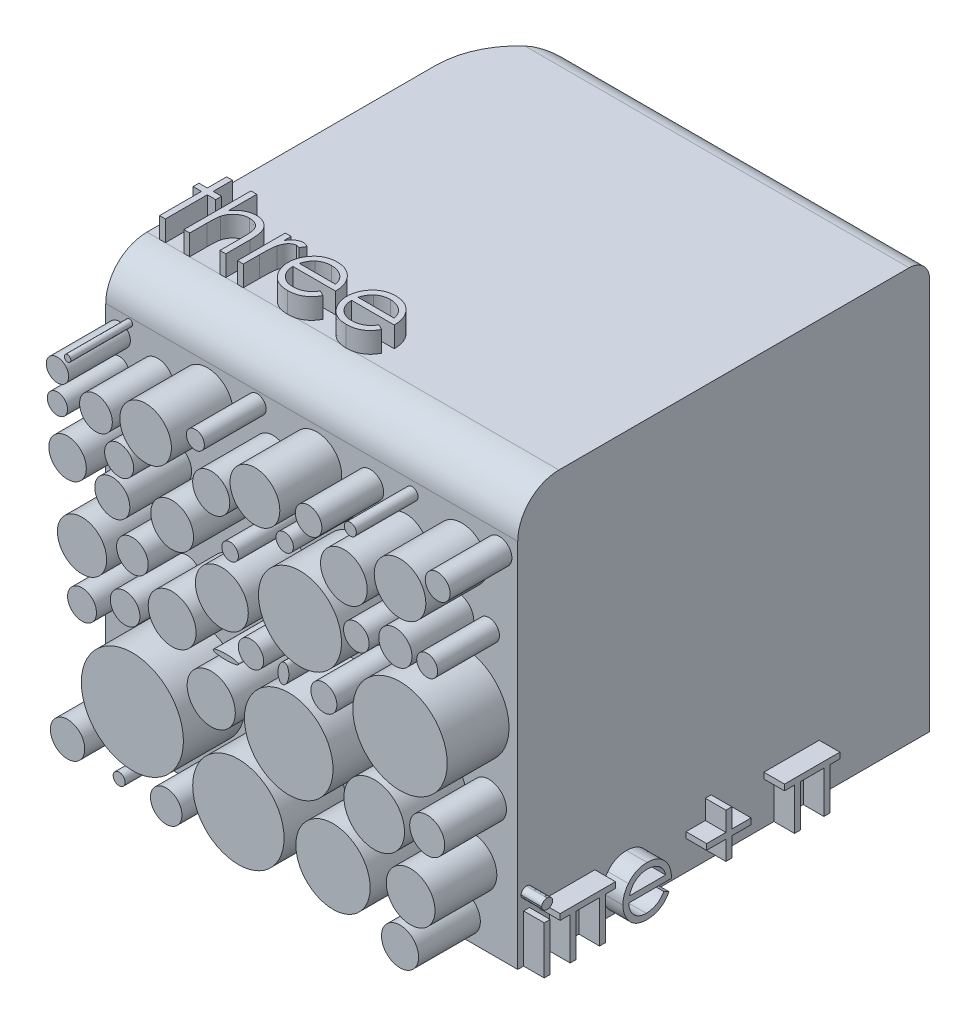
from build123d import *
from OCP.BRepFilletAPI import BRepFilletAPI_MakeFillet

# Parameters (mm, degrees)
SKETCH2_W           = 20
SKETCH2_H           = 20
BOSS_EXTRUDE1_DEPTH = 20
SKETCH3_W           = 0.284935898
SKETCH3_H           = 2.320192308
BOSS_EXTRUDE2_DEPTH = 1
FILLET1_R1          = 2
FILLET1_R2          = 1
FILLET1_R3          = 4
BOSS_EXTRUDE3_DEPTH = 1
SKETCH5_R           = 0.869274054
SKETCH5_R_2         = 1.87334708
SKETCH5_R_3         = 1.224259222
SKETCH5_R_4         = 0.854359486
SKETCH5_R_5         = 0.723058737
SKETCH5_R_6         = 0.828150602
SKETCH5_R_7         = 1.20534194
SKETCH5_R_8         = 2.196982283
SKETCH5_R_9         = 1.648859169
SKETCH5_R_10        = 0.887298728
SKETCH5_R_11        = 1.198491665
SKETCH5_R_12        = 1.240938395
SKETCH5_R_13        = 1.52286101
SKETCH5_R_14        = 2.08407997
SKETCH5_R_15        = 1.116428312
SKETCH5_R_16        = 0.510356374
SKETCH5_R_17        = 0.928303522
SKETCH5_R_18        = 1.048285303
SKETCH5_R_19        = 1.120954627
SKETCH5_R_20        = 1.035138007
SKETCH5_R_21        = 1.063032749
SKETCH5_R_22        = 0.901829478
SKETCH5_R_23        = 0.83084329
SKETCH5_R_24        = 0.806786337
SKETCH5_R_25        = 0.775997991
SKETCH5_R_26        = 0.848871038
SKETCH5_R_27        = 0.739481873
SKETCH5_R_28        = 1.066466648
SKETCH5_R_29        = 0.843889534
SKETCH5_R_30        = 0.704115082
SKETCH5_R_31        = 0.319725843
SKETCH5_R_32        = 0.681387214
SKETCH5_R_33        = 0.790534868
SKETCH5_R_34        = 0.573713006
SKETCH5_R_35        = 0.533233324
SKETCH5_R_36        = 0.625054899
SKETCH5_R_37        = 0.340042365
SKETCH5_R_38        = 0.519725647
SKETCH5_R_39        = 0.813729973
SKETCH5_R_40        = 0.720290961
SKETCH5_R_41        = 0.811333119
SKETCH5_R_42        = 0.907849135
SKETCH5_R_43        = 0.760866236
SKETCH5_R_44        = 0.443440105
SKETCH5_R_45        = 0.505502597
SKETCH5_R_46        = 0.653372918
SKETCH5_R_47        = 0.821463246
SKETCH5_R_48        = 0.243410693
SKETCH5_R_49        = 0.331818637
SKETCH5_R_50        = 0.58557289
SKETCH5_R_51        = 0.913548579
SKETCH5_R_52        = 0.618089992
SKETCH5_R_53        = 0.33645039
SKETCH5_R_54        = 0.353045631
SKETCH5_R_55        = 0.558214156
SKETCH5_R_56        = 0.708578995
SKETCH5_R_57        = 0.386937988
SKETCH5_R_58        = 0.620695254
SKETCH5_R_59        = 0.450911284
SKETCH5_R_60        = 0.446571325
SKETCH5_R_61        = 0.637073751
SKETCH5_R_62        = 0.354108624
SKETCH5_R_63        = 0.719749999
SKETCH5_RX          = 0.571418379
SKETCH5_RY          = 0.334928494
BOSS_EXTRUDE4_DEPTH = 4
SKETCH6_R           = 0.794272448
SKETCH6_R_2         = 0.85045789
SKETCH6_R_3         = 0.901030327
SKETCH6_R_4         = 1.16174239
SKETCH6_R_5         = 1.038098205
SKETCH6_R_6         = 2.014765062
SKETCH6_R_7         = 2.14961737
SKETCH6_R_8         = 2.477089822
SKETCH6_R_9         = 1.183351901
SKETCH6_R_10        = 2.217815956
SKETCH6_R_11        = 1.803840094
SKETCH6_R_12        = 1.195092222
SKETCH6_R_13        = 0.702366469
SKETCH6_R_14        = 1.252556633
SKETCH6_R_15        = 2.290309651
SKETCH6_R_16        = 1.471259211
SKETCH6_R_17        = 1.284780558
SKETCH6_R_18        = 1.169284811
SKETCH6_R_19        = 0.719100487
SKETCH6_R_20        = 0.910166483
SKETCH6_R_21        = 1.250904183
SKETCH6_R_22        = 0.643183028
SKETCH6_R_23        = 1.207146771
SKETCH6_R_24        = 1.133501294
SKETCH6_R_25        = 0.806547414
SKETCH6_R_26        = 0.403167986
SKETCH6_R_27        = 0.767115422
SKETCH6_R_28        = 0.492725753
SKETCH6_R_29        = 0.157493034
SKETCH6_R_30        = 0.541714877
SKETCH6_R_31        = 0.436948105
SKETCH6_R_32        = 0.614399725
SKETCH6_R_33        = 0.834280538
SKETCH6_R_34        = 0.764414303
SKETCH6_R_35        = 0.289432363
SKETCH6_R_36        = 0.90045624
SKETCH6_R_37        = 0.84902596
SKETCH6_R_38        = 0.633160864
SKETCH6_R_39        = 0.705305254
SKETCH6_R_40        = 0.508480831
SKETCH6_R_41        = 0.621454766
SKETCH6_R_42        = 0.603096786
SKETCH6_R_43        = 0.422088862
SKETCH6_RX          = 0.486141315
SKETCH6_RY          = 0.259275368
SKETCH6_RX_2        = 0.611023877
SKETCH6_RY_2        = 0.128636606
BOSS_EXTRUDE5_DEPTH = 3
SKETCH8_W           = 0.284935897
SKETCH8_H           = 3.256410256
BOSS_EXTRUDE6_DEPTH = 1


with BuildPart() as part:
    # Sketch2 → Boss-Extrude1 (new body)
    with BuildSketch(Plane(origin=(0, 0, 0), x_dir=(1, 0, 0), z_dir=(0, 1, 0))):
        with Locations((10, -10)):
            Rectangle(SKETCH2_W, SKETCH2_H)
    extrude(amount=BOSS_EXTRUDE1_DEPTH)

    # Sketch3 → Boss-Extrude2 (add)
    # profile 1 of 6: a face of its own
    with BuildSketch(Plane(origin=(20, 0, 0), x_dir=(0, 0, -1), z_dir=(1, 0, 0))):
        with BuildLine():
            add(Edge.make_bspline(
                [(-19.573868189, 3.297115385), (-19.556186781, 3.296295189), (-19.521563189, 3.294689089), (-19.47149501, 3.280935463), (-19.425904721, 3.257622177), (-19.385466349, 3.226344181), (-19.350766423, 3.189560043), (-19.326472493, 3.146687593), (-19.310858391, 3.100370114), (-19.308972844, 3.06806214), (-19.308012821, 3.05161258)],
                knots=[0, 0, 0, 0, 1.055194115, 2.066272739, 3.074728998, 4.095836921, 5.109056067, 6.073838105, 7.019297344, 8, 8, 8, 8], degree=3))
            add(Edge.make_bspline(
                [(-19.308012821, 3.05161258), (-19.308994494, 3.03559003), (-19.310935147, 3.003915346), (-19.326460432, 2.958400839), (-19.350973462, 2.916124096), (-19.385444098, 2.879411381), (-19.425910617, 2.848150675), (-19.471493444, 2.824832805), (-19.521563601, 2.811080395), (-19.55618692, 2.809474127), (-19.573868189, 2.808653846)],
                knots=[0, 0, 0, 0, 0.96129708, 1.900370562, 2.859976407, 3.87933698, 4.906634145, 5.921202961, 6.938410037, 8, 8, 8, 8], degree=3))
            add(Edge.make_bspline(
                [(-19.573868189, 2.808653846), (-19.591347267, 2.809442807), (-19.625368009, 2.810978415), (-19.674686502, 2.825102646), (-19.71988806, 2.848158655), (-19.760405299, 2.879206694), (-19.794178403, 2.916349565), (-19.818760455, 2.958375039), (-19.834249885, 3.003921915), (-19.836195369, 3.035592237), (-19.837179487, 3.05161258)],
                knots=[0, 0, 0, 0, 1.054934014, 2.053291228, 3.073705704, 4.106921865, 5.123545215, 6.088680038, 7.033164197, 8, 8, 8, 8], degree=3))
            add(Edge.make_bspline(
                [(-19.837179487, 3.05161258), (-19.83621693, 3.068059851), (-19.834326407, 3.100363328), (-19.818748845, 3.146713822), (-19.794383162, 3.189332756), (-19.760382936, 3.226548745), (-19.719894012, 3.257614247), (-19.674684964, 3.280665637), (-19.625368416, 3.294791066), (-19.591347405, 3.296326509), (-19.573868189, 3.297115385)],
                knots=[0, 0, 0, 0, 0.98631895, 1.937192651, 2.907499808, 3.917963147, 4.944918757, 5.95915025, 6.951458133, 8, 8, 8, 8], degree=3))
        make_face()
    # profile 2 of 6: a face of its own
    with BuildSketch(Plane(origin=(20, 0, 0), x_dir=(0, 0, -1), z_dir=(1, 0, 0))):
        with Locations((-19.572596154, 1.160096154)):
            Rectangle(SKETCH3_W, SKETCH3_H)
    # profile 3 of 6: a face of its own
    with BuildSketch(Plane(origin=(20, 0, 0), x_dir=(0, 0, -1), z_dir=(1, 0, 0))):
        Polygon((-16.256585145, 2.03525641), (-16.745046683, 2.03525641), (-16.745046683, 0), (-17.029982581, 0), (-17.029982581, 2.03525641), (-18.169726171, 2.03525641), (-18.169726171, 0), (-18.454662068, 0), (-18.454662068, 2.03525641), (-18.943123606, 2.03525641), (-18.943123606, 2.320192308), (-16.256585145, 2.320192308), align=None)
    # profile 4 of 6: a face of its own
    with BuildSketch(Plane(origin=(20, 0, 0), x_dir=(0, 0, -1), z_dir=(1, 0, 0))):
        with BuildLine():
            Line((-13.909152811, 0.732692308), (-13.656017795, 0.599764623))
            add(Edge.make_bspline(
                [(-13.656017795, 0.599764623), (-13.676189563, 0.563983887), (-13.715435837, 0.494368744), (-13.782927944, 0.398726985), (-13.853677895, 0.312686557), (-13.930879352, 0.238546085), (-14.012222561, 0.1739109), (-14.098158612, 0.117361587), (-14.189134897, 0.069175501), (-14.285155718, 0.028578565), (-14.387027454, -0.002635762), (-14.494996972, -0.024683162), (-14.609271115, -0.038311413), (-14.687599435, -0.039894505), (-14.727707498, -0.040705128)],
                knots=[0, 0, 0, 0, 1.120438281, 2.179929193, 3.190490725, 4.156257408, 5.095198341, 6.022838206, 6.959905092, 7.901321166, 8.864066838, 9.862729781, 10.905609505, 12, 12, 12, 12], degree=3))
            add(Edge.make_bspline(
                [(-14.727707498, -0.040705128), (-14.772286292, -0.039664476), (-14.859246605, -0.037634466), (-14.985829089, -0.020133445), (-15.10500899, 0.008416481), (-15.216779607, 0.048299508), (-15.320867222, 0.100394295), (-15.417478712, 0.163857539), (-15.507122139, 0.238363227), (-15.586972671, 0.324556715), (-15.658858193, 0.416796776), (-15.722290902, 0.5129139), (-15.775320143, 0.612666254), (-15.818457153, 0.7154188), (-15.853295852, 0.820523904), (-15.877577076, 0.928937878), (-15.891574062, 1.040367301), (-15.893718952, 1.115748455), (-15.894799846, 1.153735978)],
                knots=[0, 0, 0, 0, 1.145258523, 2.234067595, 3.276747158, 4.290159414, 5.277019952, 6.260822364, 7.254936242, 8.264827045, 9.274100331, 10.257902744, 11.220704747, 12.172965371, 13.118907548, 14.062713208, 15.023725156, 16, 16, 16, 16], degree=3))
            add(Edge.make_bspline(
                [(-15.894799846, 1.153735978), (-15.893839054, 1.189382002), (-15.89193489, 1.260027716), (-15.879932675, 1.364590031), (-15.858661724, 1.466215842), (-15.829473201, 1.564989591), (-15.791780285, 1.660745898), (-15.745668201, 1.753543042), (-15.691065115, 1.843282276), (-15.648907761, 1.899890833), (-15.627672442, 1.928405449)],
                knots=[0, 0, 0, 0, 1.024358464, 2.0301432, 3.019427413, 4.004406732, 4.986367066, 5.972626655, 6.978780325, 8, 8, 8, 8], degree=3))
            add(Edge.make_bspline(
                [(-15.627672442, 1.928405449), (-15.598909044, 1.962757924), (-15.5422934, 2.030374674), (-15.446538706, 2.119218727), (-15.342852099, 2.193644152), (-15.232532981, 2.25533634), (-15.11429918, 2.302211719), (-14.989740037, 2.337143598), (-14.857437256, 2.356717936), (-14.766990377, 2.359482757), (-14.720711304, 2.360897436)],
                knots=[0, 0, 0, 0, 1.030682036, 2.02871468, 2.997146059, 3.962720338, 4.930598197, 5.918074684, 6.934738563, 8, 8, 8, 8], degree=3))
            add(Edge.make_bspline(
                [(-14.720711304, 2.360897436), (-14.673133834, 2.35966912), (-14.579797682, 2.357259445), (-14.443697115, 2.334919842), (-14.314918465, 2.299493596), (-14.193513265, 2.249461229), (-14.079469206, 2.18490935), (-13.973527575, 2.104952108), (-13.87387656, 2.012044272), (-13.815902349, 1.940594789), (-13.786401409, 1.904236779)],
                knots=[0, 0, 0, 0, 1.056321875, 2.072262726, 3.055038591, 4.01806755, 4.982017516, 5.957941055, 6.960871419, 8, 8, 8, 8], degree=3))
            add(Edge.make_bspline(
                [(-13.786401409, 1.904236779), (-13.766329115, 1.876837816), (-13.726318134, 1.822222265), (-13.676201121, 1.733167001), (-13.632696913, 1.639993819), (-13.597923441, 1.541196621), (-13.56976618, 1.437946002), (-13.549394637, 1.329503836), (-13.537447911, 1.215902417), (-13.535099593, 1.138499042), (-13.53390241, 1.099038462)],
                knots=[0, 0, 0, 0, 0.94817472, 1.890038105, 2.849395472, 3.817997239, 4.812318967, 5.836947057, 6.897266129, 8, 8, 8, 8], degree=3))
            Line((-13.53390241, 1.099038462), (-15.609863949, 1.099038462))
            add(Edge.make_bspline(
                [(-15.609863949, 1.099038462), (-15.608467306, 1.068467326), (-15.605720864, 1.008350421), (-15.592916412, 0.920384068), (-15.572733596, 0.836588251), (-15.544368089, 0.757591491), (-15.510017451, 0.682362018), (-15.467938979, 0.611457885), (-15.417738098, 0.545202048), (-15.361744071, 0.483001859), (-15.29941692, 0.427611026), (-15.233846142, 0.378034057), (-15.164092694, 0.336481837), (-15.090706576, 0.302754366), (-15.013806456, 0.276350779), (-14.933368108, 0.258327828), (-14.849549816, 0.246256381), (-14.792412758, 0.244914113), (-14.763324485, 0.244230769)],
                knots=[0, 0, 0, 0, 1.094153842, 2.151609401, 3.174256925, 4.172055639, 5.149267565, 6.128595816, 7.11444997, 8.118368179, 9.117203808, 10.09244225, 11.054858984, 12.015122123, 12.976791628, 13.957293641, 14.960065497, 16, 16, 16, 16], degree=3))
            add(Edge.make_bspline(
                [(-14.763324485, 0.244230769), (-14.734884516, 0.244782363), (-14.678454161, 0.245876832), (-14.594415669, 0.256519351), (-14.511739097, 0.273728102), (-14.430766634, 0.297214021), (-14.353141652, 0.325858737), (-14.281254617, 0.360423472), (-14.21514185, 0.398659314), (-14.153350031, 0.442392376), (-14.093414201, 0.495921231), (-14.033957803, 0.56271935), (-13.970206839, 0.641720179), (-13.930301994, 0.701179461), (-13.909152811, 0.732692308)],
                knots=[0, 0, 0, 0, 0.99110716, 1.966546729, 2.947904876, 3.932708344, 4.903319531, 5.828989031, 6.710028674, 7.56322171, 8.463672341, 9.504779593, 10.677557249, 12, 12, 12, 12], degree=3))
        make_face()
        with BuildLine():
            add(Edge.make_bspline(
                [(-13.818838308, 1.383974359), (-13.829267388, 1.421768537), (-13.849340012, 1.494510165), (-13.891283, 1.595240115), (-13.938519326, 1.68476414), (-13.994419039, 1.762397092), (-14.057754598, 1.831343136), (-14.130911299, 1.891594282), (-14.212949574, 1.945494398), (-14.303445366, 1.990989879), (-14.399277556, 2.02971568), (-14.499613173, 2.055682749), (-14.60199131, 2.073471405), (-14.671237412, 2.075127947), (-14.706082899, 2.075961538)],
                knots=[0, 0, 0, 0, 1.154881502, 2.222775134, 3.210006277, 4.132804581, 5.035138423, 5.962687519, 6.919655026, 7.923214229, 8.944639381, 9.960483929, 10.97369054, 12, 12, 12, 12], degree=3))
            add(Edge.make_bspline(
                [(-14.706082899, 2.075961538), (-14.734521318, 2.075406665), (-14.790738094, 2.074309797), (-14.873561206, 2.063904751), (-14.953099219, 2.046705463), (-15.029939015, 2.023151538), (-15.10307366, 1.991756592), (-15.174007485, 1.954941807), (-15.240936845, 1.910000514), (-15.282793592, 1.875747838), (-15.303939469, 1.85844351)],
                knots=[0, 0, 0, 0, 1.04873581, 2.073130211, 3.073294108, 4.04793562, 5.032784715, 6.005352987, 6.992311501, 8, 8, 8, 8], degree=3))
            add(Edge.make_bspline(
                [(-15.303939469, 1.85844351), (-15.319082661, 1.844750809), (-15.34972879, 1.81704012), (-15.390677691, 1.769297911), (-15.429884835, 1.717816137), (-15.465566077, 1.660625203), (-15.498293602, 1.598376353), (-15.528918724, 1.531594641), (-15.55648354, 1.459773302), (-15.571992154, 1.409724017), (-15.57997112, 1.383974359)],
                knots=[0, 0, 0, 0, 0.879870761, 1.780643979, 2.707998968, 3.669668524, 4.684282772, 5.740141944, 6.837334558, 8, 8, 8, 8], degree=3))
            Line((-15.57997112, 1.383974359), (-13.818838308, 1.383974359))
        make_face(mode=Mode.SUBTRACT)
    # profile 5 of 6: a face of its own
    with BuildSketch(Plane(origin=(20, 0, 0), x_dir=(0, 0, -1), z_dir=(1, 0, 0))):
        Polygon((-10.894403598, 1.709615385), (-10.894403598, 2.645833333), (-10.6094677, 2.645833333), (-10.6094677, 1.709615385), (-9.673249751, 1.709615385), (-9.673249751, 1.424679487), (-10.6094677, 1.424679487), (-10.6094677, 0.488461538), (-10.894403598, 0.488461538), (-10.894403598, 1.424679487), (-11.830621546, 1.424679487), (-11.830621546, 1.709615385), align=None)
    # profile 6 of 6: a face of its own
    with BuildSketch(Plane(origin=(20, 0, 0), x_dir=(0, 0, -1), z_dir=(1, 0, 0))):
        Polygon((-5.364587302, 2.03525641), (-5.85304884, 2.03525641), (-5.85304884, 0), (-6.137984738, 0), (-6.137984738, 2.03525641), (-7.277728327, 2.03525641), (-7.277728327, 0), (-7.562664225, 0), (-7.562664225, 2.03525641), (-8.051125763, 2.03525641), (-8.051125763, 2.320192308), (-5.364587302, 2.320192308), align=None)
    extrude(amount=BOSS_EXTRUDE2_DEPTH)

    # Fillet1: one fillet with a radius per group of edges: ONE call of the kernel's fillet builder (fillet() takes one radius for all edges)
    fillet1_edges_1 = [part.edges().sort_by_distance(p)[0] for p in [
        (10, 20, 20),
    ]]
    fillet1_edges_2 = [part.edges().sort_by_distance(p)[0] for p in [
        (10, 20, 0),
    ]]
    fillet1_edges_3 = [part.edges().sort_by_distance(p)[0] for p in [
        (0, 10, 0),
    ]]
    fillet1 = BRepFilletAPI_MakeFillet(part.part.solid().wrapped)
    for e in fillet1_edges_1:
        fillet1.Add(FILLET1_R1, e.wrapped)
    for e in fillet1_edges_2:
        fillet1.Add(FILLET1_R2, e.wrapped)
    for e in fillet1_edges_3:
        fillet1.Add(FILLET1_R3, e.wrapped)
    add(Compound.cast(fillet1.Shape()), mode=Mode.REPLACE)

    # Sketch4 → Boss-Extrude3 (add)
    # profile 1 of 5: a face of its own
    with BuildSketch(Plane(origin=(0, 20, 0), x_dir=(1, 0, 0), z_dir=(0, 1, 0))):
        Polygon((0.610576923, -14.743589744), (0.895512821, -14.743589744), (0.895512821, -15.679807692), (1.302564103, -15.679807692), (1.302564103, -15.96474359), (0.895512821, -15.96474359), (0.895512821, -18), (0.610576923, -18), (0.610576923, -15.96474359), (0.203525641, -15.96474359), (0.203525641, -15.679807692), (0.610576923, -15.679807692), align=None)
    # profile 2 of 5: a face of its own
    with BuildSketch(Plane(origin=(0, 20, 0), x_dir=(1, 0, 0), z_dir=(0, 1, 0))):
        with BuildLine():
            Line((1.791025641, -14.743589744), (2.075961538, -14.743589744))
            Line((2.075961538, -14.743589744), (2.075961538, -16.118023838))
            add(Edge.make_bspline(
                [(2.075961538, -16.118023838), (2.106547948, -16.079793226), (2.166101254, -16.005356265), (2.266337017, -15.90823647), (2.369271308, -15.824054864), (2.478459386, -15.757043806), (2.591898072, -15.704106085), (2.710065807, -15.666561577), (2.832984545, -15.643473796), (2.916464502, -15.640572374), (2.958754006, -15.639102564)],
                knots=[0, 0, 0, 0, 1.125788106, 2.19196713, 3.20547328, 4.180437432, 5.132270164, 6.079753143, 7.027236121, 8, 8, 8, 8], degree=3))
            add(Edge.make_bspline(
                [(2.958754006, -15.639102564), (3.001689434, -15.640685919), (3.085724423, -15.643784926), (3.208081178, -15.668289921), (3.322345686, -15.710161311), (3.428178272, -15.767462827), (3.523269248, -15.83883032), (3.607497248, -15.921227487), (3.676295687, -16.01672597), (3.723103457, -16.104951286), (3.753559334, -16.183454299), (3.772837777, -16.250797421), (3.789183764, -16.325838013), (3.803425667, -16.408537449), (3.81291763, -16.499292712), (3.82054182, -16.597694357), (3.825963317, -16.703736743), (3.826173416, -16.777142969), (3.826282051, -16.815099159)],
                knots=[0, 0, 0, 0, 1.235656852, 2.418478516, 3.575258207, 4.727955599, 5.870717718, 6.98870536, 8.107142894, 9.245821548, 9.854588956, 10.528768408, 11.260415777, 12.065282286, 12.943670737, 13.886611085, 14.907229059, 16, 16, 16, 16], degree=3))
            Line((3.826282051, -16.815099159), (3.826282051, -18))
            Line((3.826282051, -18), (3.541346154, -18))
            Line((3.541346154, -18), (3.541346154, -16.90859375))
            add(Edge.make_bspline(
                [(3.541346154, -16.90859375), (3.541173522, -16.877004614), (3.540843306, -16.816579973), (3.5397517, -16.730069289), (3.537314919, -16.651604938), (3.53337717, -16.581438389), (3.529235784, -16.519471821), (3.523535918, -16.465795221), (3.516904491, -16.420334868), (3.510945668, -16.392971241), (3.508273237, -16.380699119)],
                knots=[0, 0, 0, 0, 1.430932559, 2.737130458, 3.918967929, 4.986496826, 5.920444988, 6.731744033, 7.431208747, 8, 8, 8, 8], degree=3))
            add(Edge.make_bspline(
                [(3.508273237, -16.380699119), (3.497909815, -16.344690751), (3.477986196, -16.275464874), (3.431678388, -16.181428259), (3.373839856, -16.101250672), (3.303221269, -16.03601414), (3.221071896, -15.984840815), (3.126856071, -15.949400755), (3.021460524, -15.927404607), (2.947209546, -15.925191811), (2.908508614, -15.924038462)],
                knots=[0, 0, 0, 0, 1.090059168, 2.095632401, 3.037101401, 3.955032261, 4.878929692, 5.839099886, 6.873700383, 8, 8, 8, 8], degree=3))
            add(Edge.make_bspline(
                [(2.908508614, -15.924038462), (2.885587134, -15.924470104), (2.840226117, -15.925324313), (2.772962685, -15.93390035), (2.707712748, -15.947914544), (2.643847916, -15.966877947), (2.582721729, -15.992682113), (2.522552463, -16.022554499), (2.465044859, -16.059119844), (2.409177725, -16.100146076), (2.357182534, -16.145566501), (2.308807222, -16.193506239), (2.265683157, -16.244555671), (2.226613792, -16.297895776), (2.192887776, -16.354258189), (2.163448194, -16.413099392), (2.138469384, -16.474496767), (2.126057227, -16.517109858), (2.119846755, -16.53843149)],
                knots=[0, 0, 0, 0, 1.024319606, 2.027102035, 3.025350316, 4.005802111, 5.00026367, 5.987881639, 7.005602596, 8.042517216, 9.083927026, 10.089214625, 11.084353441, 12.06828073, 13.041928858, 14.016821737, 15.00770877, 16, 16, 16, 16], degree=3))
            add(Edge.make_bspline(
                [(2.119846755, -16.53843149), (2.116273132, -16.553871924), (2.108485767, -16.587518531), (2.100035882, -16.643012382), (2.092472309, -16.707497876), (2.086078268, -16.780877207), (2.082156611, -16.863419262), (2.077930921, -16.954560775), (2.076357923, -17.054872651), (2.076097615, -17.124627861), (2.075961538, -17.161092748)],
                knots=[0, 0, 0, 0, 0.607992626, 1.324890765, 2.152360218, 3.099583803, 4.150613268, 5.323148443, 6.60066238, 8, 8, 8, 8], degree=3))
            Line((2.075961538, -17.161092748), (2.075961538, -18))
            Line((2.075961538, -18), (1.791025641, -18))
            Line((1.791025641, -18), (1.791025641, -14.743589744))
        make_face()
    # profile 3 of 5: a face of its own
    with BuildSketch(Plane(origin=(0, 20, 0), x_dir=(1, 0, 0), z_dir=(0, 1, 0))):
        with BuildLine():
            Line((4.396153846, -15.679807692), (4.681089744, -15.679807692))
            Line((4.681089744, -15.679807692), (4.681089744, -16.021349159))
            add(Edge.make_bspline(
                [(4.681089744, -16.021349159), (4.70212526, -15.989548514), (4.742355523, -15.928730029), (4.80922368, -15.848294306), (4.877715988, -15.781696371), (4.948160337, -15.728625322), (5.021074756, -15.688880564), (5.09485899, -15.659767597), (5.170673881, -15.642552461), (5.221620769, -15.64025407), (5.247145433, -15.639102564)],
                knots=[0, 0, 0, 0, 1.2804753, 2.448899062, 3.506932113, 4.484331642, 5.4025378, 6.288909075, 7.142734305, 8, 8, 8, 8], degree=3))
            add(Edge.make_bspline(
                [(5.247145433, -15.639102564), (5.266945029, -15.640182542), (5.307683985, -15.642404666), (5.369353905, -15.658017343), (5.432893323, -15.682943835), (5.473843917, -15.706384608), (5.495192308, -15.718604768)],
                knots=[0, 0, 0, 0, 0.901110191, 1.854092781, 2.881294221, 4, 4, 4, 4], degree=3))
            Line((5.495192308, -15.718604768), (5.338731971, -15.965379607))
            add(Edge.make_bspline(
                [(5.338731971, -15.965379607), (5.325025931, -15.959265223), (5.299009242, -15.947658951), (5.260950457, -15.933922985), (5.225860958, -15.925834976), (5.20350573, -15.924609682), (5.193083934, -15.924038462)],
                knots=[0, 0, 0, 0, 1.180555205, 2.24091978, 3.179933427, 4, 4, 4, 4], degree=3))
            add(Edge.make_bspline(
                [(5.193083934, -15.924038462), (5.170218733, -15.925562495), (5.123580351, -15.928671083), (5.055105126, -15.95310843), (4.988659447, -15.992592041), (4.935889439, -16.036380835), (4.895029681, -16.078606337), (4.865873905, -16.115480245), (4.839128842, -16.156826575), (4.813574428, -16.201938502), (4.790291432, -16.251586291), (4.768561125, -16.305273921), (4.748913442, -16.363063573), (4.737710006, -16.403324859), (4.731971154, -16.423948317)],
                knots=[0, 0, 0, 0, 1.125678352, 2.296057538, 3.5422874, 4.923748041, 5.663163013, 6.437101912, 7.23742474, 8.08941207, 8.991984279, 9.93940061, 10.944477711, 12, 12, 12, 12], degree=3))
            add(Edge.make_bspline(
                [(4.731971154, -16.423948317), (4.727678197, -16.44234261), (4.718169624, -16.483084572), (4.708924443, -16.551436448), (4.699789952, -16.632193624), (4.693352305, -16.725580891), (4.687385081, -16.831365036), (4.684019507, -16.949707215), (4.681204515, -17.080728898), (4.681129161, -17.172327062), (4.681089744, -17.220242388)],
                knots=[0, 0, 0, 0, 0.566838948, 1.255505196, 2.06880316, 3.007127437, 4.065329342, 5.249902469, 6.561414163, 8, 8, 8, 8], degree=3))
            Line((4.681089744, -17.220242388), (4.681089744, -18))
            Line((4.681089744, -18), (4.396153846, -18))
            Line((4.396153846, -18), (4.396153846, -15.679807692))
        make_face()
    # profile 4 of 5: a face of its own
    with BuildSketch(Plane(origin=(0, 20, 0), x_dir=(1, 0, 0), z_dir=(0, 1, 0))):
        with BuildLine():
            Line((7.684364984, -17.267307692), (7.9375, -17.400235377))
            add(Edge.make_bspline(
                [(7.9375, -17.400235377), (7.917328231, -17.436016113), (7.878081958, -17.505631256), (7.810589851, -17.601273015), (7.739839899, -17.687313443), (7.662638443, -17.761453915), (7.581295234, -17.8260891), (7.495359183, -17.882638413), (7.404382898, -17.930824499), (7.308362076, -17.971421435), (7.206490341, -18.002635762), (7.098520822, -18.024683162), (6.98424668, -18.038311413), (6.90591836, -18.039894505), (6.865810296, -18.040705128)],
                knots=[0, 0, 0, 0, 1.120438281, 2.179929193, 3.190490725, 4.156257408, 5.095198341, 6.022838206, 6.959905092, 7.901321166, 8.864066838, 9.862729781, 10.905609505, 12, 12, 12, 12], degree=3))
            add(Edge.make_bspline(
                [(6.865810296, -18.040705128), (6.821231503, -18.039664476), (6.73427119, -18.037634466), (6.607688705, -18.020133445), (6.488508804, -17.991583519), (6.376738188, -17.951700492), (6.272650573, -17.899605705), (6.176039083, -17.836142461), (6.086395656, -17.761636773), (6.006545124, -17.675443285), (5.934659601, -17.583203224), (5.871226893, -17.4870861), (5.818197652, -17.387333746), (5.775060642, -17.2845812), (5.740221943, -17.179476096), (5.715940718, -17.071062122), (5.701943733, -16.959632699), (5.699798843, -16.884251545), (5.698717949, -16.846264022)],
                knots=[0, 0, 0, 0, 1.145258523, 2.234067595, 3.276747158, 4.290159414, 5.277019952, 6.260822364, 7.254936242, 8.264827045, 9.274100331, 10.257902744, 11.220704747, 12.172965371, 13.118907548, 14.062713208, 15.023725156, 16, 16, 16, 16], degree=3))
            add(Edge.make_bspline(
                [(5.698717949, -16.846264022), (5.699678741, -16.810617998), (5.701582905, -16.739972284), (5.713585119, -16.635409969), (5.734856071, -16.533784158), (5.764044593, -16.435010409), (5.80173751, -16.339254102), (5.847849594, -16.246456958), (5.90245268, -16.156717724), (5.944610034, -16.100109167), (5.965845353, -16.071594551)],
                knots=[0, 0, 0, 0, 1.024358464, 2.0301432, 3.019427413, 4.004406732, 4.986367066, 5.972626655, 6.978780325, 8, 8, 8, 8], degree=3))
            add(Edge.make_bspline(
                [(5.965845353, -16.071594551), (5.994608751, -16.037242076), (6.051224395, -15.969625326), (6.146979089, -15.880781273), (6.250665695, -15.806355848), (6.360984813, -15.74466366), (6.479218615, -15.697788281), (6.603777757, -15.662856402), (6.736080539, -15.643282064), (6.826527418, -15.640517243), (6.87280649, -15.639102564)],
                knots=[0, 0, 0, 0, 1.030682036, 2.02871468, 2.997146059, 3.962720338, 4.930598197, 5.918074684, 6.934738563, 8, 8, 8, 8], degree=3))
            add(Edge.make_bspline(
                [(6.87280649, -15.639102564), (6.920383961, -15.64033088), (7.013720113, -15.642740555), (7.14982068, -15.665080158), (7.27859933, -15.700506404), (7.40000453, -15.750538771), (7.514048589, -15.81509065), (7.61999022, -15.895047892), (7.719641235, -15.987955728), (7.777615446, -16.059405211), (7.807116386, -16.095763221)],
                knots=[0, 0, 0, 0, 1.056321875, 2.072262726, 3.055038591, 4.01806755, 4.982017516, 5.957941055, 6.960871419, 8, 8, 8, 8], degree=3))
            add(Edge.make_bspline(
                [(7.807116386, -16.095763221), (7.82718868, -16.123162184), (7.867199661, -16.177777735), (7.917316673, -16.266832999), (7.960820882, -16.360006181), (7.995594353, -16.458803379), (8.023751615, -16.562053998), (8.044123158, -16.670496164), (8.056069883, -16.784097583), (8.058418202, -16.861500958), (8.059615385, -16.900961538)],
                knots=[0, 0, 0, 0, 0.94817472, 1.890038105, 2.849395472, 3.817997239, 4.812318967, 5.836947057, 6.897266129, 8, 8, 8, 8], degree=3))
            Line((8.059615385, -16.900961538), (5.983653846, -16.900961538))
            add(Edge.make_bspline(
                [(5.983653846, -16.900961538), (5.985050489, -16.931532674), (5.987796931, -16.991649579), (6.000601383, -17.079615932), (6.020784199, -17.163411749), (6.049149706, -17.242408509), (6.083500344, -17.317637982), (6.125578815, -17.388542115), (6.175779696, -17.454797952), (6.231773724, -17.516998141), (6.294100875, -17.572388974), (6.359671652, -17.621965943), (6.429425101, -17.663518163), (6.502811219, -17.697245634), (6.579711339, -17.723649221), (6.660149687, -17.741672172), (6.743967978, -17.753743619), (6.801105037, -17.755085887), (6.830193309, -17.755769231)],
                knots=[0, 0, 0, 0, 1.094153842, 2.151609401, 3.174256925, 4.172055639, 5.149267565, 6.128595816, 7.11444997, 8.118368179, 9.117203808, 10.09244225, 11.054858984, 12.015122123, 12.976791628, 13.957293641, 14.960065497, 16, 16, 16, 16], degree=3))
            add(Edge.make_bspline(
                [(6.830193309, -17.755769231), (6.858633279, -17.755217637), (6.915063634, -17.754123168), (6.999102126, -17.743480649), (7.081778698, -17.726271898), (7.162751161, -17.702785979), (7.240376143, -17.674141263), (7.312263177, -17.639576528), (7.378375944, -17.601340686), (7.440167764, -17.557607624), (7.500103594, -17.504078769), (7.559559992, -17.43728065), (7.623310956, -17.358279821), (7.663215801, -17.298820539), (7.684364984, -17.267307692)],
                knots=[0, 0, 0, 0, 0.99110716, 1.966546729, 2.947904876, 3.932708344, 4.903319531, 5.828989031, 6.710028674, 7.56322171, 8.463672341, 9.504779593, 10.677557249, 12, 12, 12, 12], degree=3))
        make_face()
        with BuildLine():
            add(Edge.make_bspline(
                [(7.774679487, -16.616025641), (7.764250406, -16.578231463), (7.744177783, -16.505489835), (7.702234795, -16.404759885), (7.654998469, -16.31523586), (7.599098755, -16.237602908), (7.535763197, -16.168656864), (7.462606496, -16.108405718), (7.380568221, -16.054505602), (7.290072429, -16.009010121), (7.194240238, -15.97028432), (7.093904621, -15.944317251), (6.991526485, -15.926528595), (6.922280383, -15.924872053), (6.887434896, -15.924038462)],
                knots=[0, 0, 0, 0, 1.154881502, 2.222775134, 3.210006277, 4.132804581, 5.035138423, 5.962687519, 6.919655026, 7.923214229, 8.944639381, 9.960483929, 10.97369054, 12, 12, 12, 12], degree=3))
            add(Edge.make_bspline(
                [(6.887434896, -15.924038462), (6.858996477, -15.924593335), (6.802779701, -15.925690203), (6.719956589, -15.936095249), (6.640418576, -15.953294537), (6.56357878, -15.976848462), (6.490444135, -16.008243408), (6.419510309, -16.045058193), (6.35258095, -16.089999486), (6.310724203, -16.124252162), (6.289578325, -16.14155649)],
                knots=[0, 0, 0, 0, 1.04873581, 2.073130211, 3.073294108, 4.04793562, 5.032784715, 6.005352987, 6.992311501, 8, 8, 8, 8], degree=3))
            add(Edge.make_bspline(
                [(6.289578325, -16.14155649), (6.274435134, -16.155249191), (6.243789005, -16.18295988), (6.202840103, -16.230702089), (6.16363296, -16.282183863), (6.127951718, -16.339374797), (6.095224193, -16.401623647), (6.064599071, -16.468405359), (6.037034254, -16.540226698), (6.02152564, -16.590275983), (6.013546675, -16.616025641)],
                knots=[0, 0, 0, 0, 0.879870761, 1.780643979, 2.707998968, 3.669668524, 4.684282772, 5.740141944, 6.837334558, 8, 8, 8, 8], degree=3))
            Line((6.013546675, -16.616025641), (7.774679487, -16.616025641))
        make_face(mode=Mode.SUBTRACT)
    # profile 5 of 5: a face of its own
    with BuildSketch(Plane(origin=(0, 20, 0), x_dir=(1, 0, 0), z_dir=(0, 1, 0))):
        with BuildLine():
            Line((10.533723958, -17.267307692), (10.786858974, -17.400235377))
            add(Edge.make_bspline(
                [(10.786858974, -17.400235377), (10.766687206, -17.436016113), (10.727440932, -17.505631256), (10.659948825, -17.601273015), (10.589198874, -17.687313443), (10.511997417, -17.761453915), (10.430654208, -17.8260891), (10.344718157, -17.882638413), (10.253741873, -17.930824499), (10.157721051, -17.971421435), (10.055849315, -18.002635762), (9.947879797, -18.024683162), (9.833605654, -18.038311413), (9.755277334, -18.039894505), (9.715169271, -18.040705128)],
                knots=[0, 0, 0, 0, 1.120438281, 2.179929193, 3.190490725, 4.156257408, 5.095198341, 6.022838206, 6.959905092, 7.901321166, 8.864066838, 9.862729781, 10.905609505, 12, 12, 12, 12], degree=3))
            add(Edge.make_bspline(
                [(9.715169271, -18.040705128), (9.670590477, -18.039664476), (9.583630165, -18.037634466), (9.45704768, -18.020133445), (9.337867779, -17.991583519), (9.226097162, -17.951700492), (9.122009547, -17.899605705), (9.025398058, -17.836142461), (8.93575463, -17.761636773), (8.855904098, -17.675443285), (8.784018576, -17.583203224), (8.720585868, -17.4870861), (8.667556627, -17.387333746), (8.624419616, -17.2845812), (8.589580917, -17.179476096), (8.565299693, -17.071062122), (8.551302707, -16.959632699), (8.549157817, -16.884251545), (8.548076923, -16.846264022)],
                knots=[0, 0, 0, 0, 1.145258523, 2.234067595, 3.276747158, 4.290159414, 5.277019952, 6.260822364, 7.254936242, 8.264827045, 9.274100331, 10.257902744, 11.220704747, 12.172965371, 13.118907548, 14.062713208, 15.023725156, 16, 16, 16, 16], degree=3))
            add(Edge.make_bspline(
                [(8.548076923, -16.846264022), (8.549037716, -16.810617998), (8.550941879, -16.739972284), (8.562944094, -16.635409969), (8.584215045, -16.533784158), (8.613403568, -16.435010409), (8.651096484, -16.339254102), (8.697208568, -16.246456958), (8.751811654, -16.156717724), (8.793969008, -16.100109167), (8.815204327, -16.071594551)],
                knots=[0, 0, 0, 0, 1.024358464, 2.0301432, 3.019427413, 4.004406732, 4.986367066, 5.972626655, 6.978780325, 8, 8, 8, 8], degree=3))
            add(Edge.make_bspline(
                [(8.815204327, -16.071594551), (8.843967725, -16.037242076), (8.900583369, -15.969625326), (8.996338063, -15.880781273), (9.10002467, -15.806355848), (9.210343788, -15.74466366), (9.328577589, -15.697788281), (9.453136732, -15.662856402), (9.585439514, -15.643282064), (9.675886392, -15.640517243), (9.722165465, -15.639102564)],
                knots=[0, 0, 0, 0, 1.030682036, 2.02871468, 2.997146059, 3.962720338, 4.930598197, 5.918074684, 6.934738563, 8, 8, 8, 8], degree=3))
            add(Edge.make_bspline(
                [(9.722165465, -15.639102564), (9.769742935, -15.64033088), (9.863079087, -15.642740555), (9.999179654, -15.665080158), (10.127958304, -15.700506404), (10.249363504, -15.750538771), (10.363407564, -15.81509065), (10.469349194, -15.895047892), (10.569000209, -15.987955728), (10.62697442, -16.059405211), (10.656475361, -16.095763221)],
                knots=[0, 0, 0, 0, 1.056321875, 2.072262726, 3.055038591, 4.01806755, 4.982017516, 5.957941055, 6.960871419, 8, 8, 8, 8], degree=3))
            add(Edge.make_bspline(
                [(10.656475361, -16.095763221), (10.676547655, -16.123162184), (10.716558635, -16.177777735), (10.766675648, -16.266832999), (10.810179856, -16.360006181), (10.844953328, -16.458803379), (10.87311059, -16.562053998), (10.893482132, -16.670496164), (10.905428858, -16.784097583), (10.907777176, -16.861500958), (10.908974359, -16.900961538)],
                knots=[0, 0, 0, 0, 0.94817472, 1.890038105, 2.849395472, 3.817997239, 4.812318967, 5.836947057, 6.897266129, 8, 8, 8, 8], degree=3))
            Line((10.908974359, -16.900961538), (8.833012821, -16.900961538))
            add(Edge.make_bspline(
                [(8.833012821, -16.900961538), (8.834409463, -16.931532674), (8.837155906, -16.991649579), (8.849960357, -17.079615932), (8.870143173, -17.163411749), (8.89850868, -17.242408509), (8.932859318, -17.317637982), (8.97493779, -17.388542115), (9.025138671, -17.454797952), (9.081132698, -17.516998141), (9.143459849, -17.572388974), (9.209030627, -17.621965943), (9.278784075, -17.663518163), (9.352170194, -17.697245634), (9.429070313, -17.723649221), (9.509508661, -17.741672172), (9.593326953, -17.753743619), (9.650464011, -17.755085887), (9.679552284, -17.755769231)],
                knots=[0, 0, 0, 0, 1.094153842, 2.151609401, 3.174256925, 4.172055639, 5.149267565, 6.128595816, 7.11444997, 8.118368179, 9.117203808, 10.09244225, 11.054858984, 12.015122123, 12.976791628, 13.957293641, 14.960065497, 16, 16, 16, 16], degree=3))
            add(Edge.make_bspline(
                [(9.679552284, -17.755769231), (9.707992253, -17.755217637), (9.764422609, -17.754123168), (9.848461101, -17.743480649), (9.931137672, -17.726271898), (10.012110135, -17.702785979), (10.089735117, -17.674141263), (10.161622152, -17.639576528), (10.227734919, -17.601340686), (10.289526738, -17.557607624), (10.349462568, -17.504078769), (10.408918966, -17.43728065), (10.472669931, -17.358279821), (10.512574775, -17.298820539), (10.533723958, -17.267307692)],
                knots=[0, 0, 0, 0, 0.99110716, 1.966546729, 2.947904876, 3.932708344, 4.903319531, 5.828989031, 6.710028674, 7.56322171, 8.463672341, 9.504779593, 10.677557249, 12, 12, 12, 12], degree=3))
        make_face()
        with BuildLine():
            add(Edge.make_bspline(
                [(10.624038462, -16.616025641), (10.613609381, -16.578231463), (10.593536757, -16.505489835), (10.551593769, -16.404759885), (10.504357443, -16.31523586), (10.44845773, -16.237602908), (10.385122172, -16.168656864), (10.31196547, -16.108405718), (10.229927195, -16.054505602), (10.139431403, -16.009010121), (10.043599213, -15.97028432), (9.943263596, -15.944317251), (9.84088546, -15.926528595), (9.771639357, -15.924872053), (9.73679387, -15.924038462)],
                knots=[0, 0, 0, 0, 1.154881502, 2.222775134, 3.210006277, 4.132804581, 5.035138423, 5.962687519, 6.919655026, 7.923214229, 8.944639381, 9.960483929, 10.97369054, 12, 12, 12, 12], degree=3))
            add(Edge.make_bspline(
                [(9.73679387, -15.924038462), (9.708355451, -15.924593335), (9.652138675, -15.925690203), (9.569315563, -15.936095249), (9.489777551, -15.953294537), (9.412937754, -15.976848462), (9.339803109, -16.008243408), (9.268869284, -16.045058193), (9.201939924, -16.089999486), (9.160083178, -16.124252162), (9.1389373, -16.14155649)],
                knots=[0, 0, 0, 0, 1.04873581, 2.073130211, 3.073294108, 4.04793562, 5.032784715, 6.005352987, 6.992311501, 8, 8, 8, 8], degree=3))
            add(Edge.make_bspline(
                [(9.1389373, -16.14155649), (9.123794108, -16.155249191), (9.093147979, -16.18295988), (9.052199078, -16.230702089), (9.012991935, -16.282183863), (8.977310692, -16.339374797), (8.944583168, -16.401623647), (8.913958045, -16.468405359), (8.886393229, -16.540226698), (8.870884615, -16.590275983), (8.862905649, -16.616025641)],
                knots=[0, 0, 0, 0, 0.879870761, 1.780643979, 2.707998968, 3.669668524, 4.684282772, 5.740141944, 6.837334558, 8, 8, 8, 8], degree=3))
            Line((8.862905649, -16.616025641), (10.624038462, -16.616025641))
        make_face(mode=Mode.SUBTRACT)
    extrude(amount=BOSS_EXTRUDE3_DEPTH)

    # Sketch5 → Boss-Extrude4 (add)
    with BuildSketch(Plane.XY.offset(20)):
        with Locations((2.852466063, 15.587306963)):
            Circle(SKETCH5_R)
        with Locations((10.332535753, 15.280289178)):
            Circle(SKETCH5_R_2)
        with Locations((4.387554992, 9.558594078)):
            Circle(SKETCH5_R_3)
        with Locations((7.150715064, 12.46130769)):
            Circle(SKETCH5_R_4)
        with Locations((2.517537569, 13.315667175)):
            Circle(SKETCH5_R_5)
        with Locations((11.89553539, 8.334334857)):
            Circle(SKETCH5_R_6)
        with Locations((5.057411979, 5.958112772)):
            Circle(SKETCH5_R_7)
        with Locations((13.346892196, 3.836898979)):
            Circle(SKETCH5_R_8)
        with Locations((14.798249001, 13.828932372)):
            Circle(SKETCH5_R_9)
        with Locations((9.411482396, 10.7828533)):
            Circle(SKETCH5_R_10)
        with Locations((8.005074549, 8.107237273)):
            Circle(SKETCH5_R_11)
        with Locations((8.239232668, 4.752770832)):
            Circle(SKETCH5_R_12)
        with Locations((2.517537569, 2.664649252)):
            Circle(SKETCH5_R_13)
        with Locations((16.807819963, 9.162485459)):
            Circle(SKETCH5_R_14)
        with Locations((17.282301996, 3.836898979)):
            Circle(SKETCH5_R_15)
        with Locations((17.673051905, 1.639916696)):
            Circle(SKETCH5_R_16)
        with Locations((7.625197096, 1.639916696)):
            Circle(SKETCH5_R_17)
        with Locations((11.89553539, 11.670152028)):
            Circle(SKETCH5_R_18)
        with Locations((17.673051905, 16.64791386)):
            Circle(SKETCH5_R_19)
        with Locations((5.611814213, 16.456581018)):
            Circle(SKETCH5_R_20)
        with Locations((1.401109257, 7.506184255)):
            Circle(SKETCH5_R_21)
        with Locations((1.205734302, 11.246565429)):
            Circle(SKETCH5_R_22)
        with Locations((4.387554992, 13.315667175)):
            Circle(SKETCH5_R_23)
        with Locations((5.057411979, 1.966881557)):
            Circle(SKETCH5_R_24)
        with Locations((9.858053721, 6.990808961)):
            Circle(SKETCH5_R_25)
        with Locations((13.151517241, 10.144718942)):
            Circle(SKETCH5_R_26)
        with Locations((13.598088566, 7.506184255)):
            Circle(SKETCH5_R_27)
        with Locations((9.858053721, 2.134345803)):
            Circle(SKETCH5_R_28)
        with Locations((17.673051905, 13.828932372)):
            Circle(SKETCH5_R_29)
        with Locations((18.175444645, 12.014736365)):
            Circle(SKETCH5_R_30)
        with Locations((14.337570439, 11.670152028)):
            Circle(SKETCH5_R_31)
        with Locations((13.598088566, 17.038663769)):
            Circle(SKETCH5_R_32)
        with Locations((6.732054447, 14.672821906)):
            Circle(SKETCH5_R_33)
        with Locations((5.224876226, 11.670152028)):
            Circle(SKETCH5_R_34)
        with Locations((0.842895101, 17.038663769)):
            Circle(SKETCH5_R_35)
        with Locations((0.842895101, 14.672821906)):
            Circle(SKETCH5_R_36)
        with Locations((2.852466063, 17.571897093)):
            Circle(SKETCH5_R_37)
        with Locations((7.522589315, 17.231854728)):
            Circle(SKETCH5_R_38)
        with Locations((15.523927404, 1.213292446)):
            Circle(SKETCH5_R_39)
        with Locations((11.588517604, 0.878363952)):
            Circle(SKETCH5_R_40)
        with Locations((15.523927404, 6.181398435)):
            Circle(SKETCH5_R_41)
        with Locations((18.175444645, 6.181398435)):
            Circle(SKETCH5_R_42)
        with Locations((19.08329378, 2.469274297)):
            Circle(SKETCH5_R_43)
        with Locations((16.249605807, 12.014736365)):
            Circle(SKETCH5_R_44)
        with Locations((12.314196007, 13.315667175)):
            Circle(SKETCH5_R_45)
        with Locations((9.244018149, 12.46130769)):
            Circle(SKETCH5_R_46)
        with Locations((6.732054447, 10.144718942)):
            Circle(SKETCH5_R_47)
        with Locations((15.188998911, 16.64791386)):
            Circle(SKETCH5_R_41)
        with Locations((11.80869341, 17.459246979)):
            Circle(SKETCH5_R_48)
        with Locations((12.819698604, 15.587306963)):
            Circle(SKETCH5_R_49)
        with Locations((7.522589315, 15.9191256)):
            Circle(SKETCH5_R_50)
        with Locations((3.159483848, 11.670152028)):
            Circle(SKETCH5_R_51)
        with Locations((1.401109257, 9.558594078)):
            Circle(SKETCH5_R_52)
        with Locations((2.517537569, 10.17668407)):
            Circle(SKETCH5_R_53)
        with Locations((2.517537569, 8.637540721)):
            Circle(SKETCH5_R_54)
        with Locations((0.842895101, 5.511541447)):
            Circle(SKETCH5_R_55)
        with Locations((2.517537569, 5.762737818)):
            Circle(SKETCH5_R)
        with Locations((3.386811623, 7.716487364)):
            Circle(SKETCH5_R_56)
        with Locations((5.224876226, 8.107237273)):
            Circle(SKETCH5_R_57)
        with Locations((5.057411979, 3.836898979)):
            Circle(SKETCH5_R_58)
        with Locations((6.732054447, 6.739612591)):
            Circle(SKETCH5_R_59)
        with Locations((6.281143163, 4.171827473)):
            Circle(SKETCH5_R_59)
        with Locations((10.332535753, 5.511541447)):
            Circle(SKETCH5_R_60)
        with Locations((10.137160799, 4.171827473)):
            Circle(SKETCH5_R_55)
        with Locations((11.588517604, 6.739612591)):
            Circle(SKETCH5_R_61)
        with Locations((9.578946643, 9.162485459)):
            Circle(SKETCH5_R_62)
        with Locations((10.951443853, 9.893522572)):
            Circle(SKETCH5_R_63)
        with Locations((19.08329378, 4.171827473)):
            Ellipse(SKETCH5_RX, SKETCH5_RY)
    extrude(amount=-BOSS_EXTRUDE4_DEPTH)

    # Sketch6 → Boss-Extrude5 (add)
    with BuildSketch(Plane.XY.offset(20)):
        with Locations(Location((2.524530447, 16.161052684, 0), (0, 0, 180))):
            Circle(SKETCH6_R)
        with Locations(Location((3.318802895, 13.009455844, 0), (0, 0, 180))):
            Circle(SKETCH6_R_2)
        with Locations(Location((8.120222795, 15.61434711, 0), (0, 0, 180))):
            Circle(SKETCH6_R_3)
        with Locations(Location((6.22283286, 9.343312582, 0), (0, 0, 180))):
            Circle(SKETCH6_R_4)
        with Locations(Location((6.22283286, 13.298888207, 0), (0, 0, 180))):
            Circle(SKETCH6_R_5)
        with Locations(Location((12.429549085, 12.46275027, 0), (0, 0, 180))):
            Circle(SKETCH6_R_6)
        with Locations(Location((11.882843511, 6.931376225, 0), (0, 0, 180))):
            Circle(SKETCH6_R_7)
        with Locations(Location((4.293283775, 4.487280717, 0), (0, 0, 180))):
            Circle(SKETCH6_R_8)
        with Locations(Location((17.800127373, 3.458187871, 0), (0, 0, 180))):
            Circle(SKETCH6_R_9)
        with Locations(Location((9.438748003, 2.847163994, 0), (0, 0, 180))):
            Circle(SKETCH6_R_10)
        with Locations(Location((14.032460882, 2.847163994, 0), (0, 0, 180))):
            Circle(SKETCH6_R_11)
        with Locations(Location((1.849188267, 10.243768822, 0), (0, 0, 180))):
            Circle(SKETCH6_R_12)
        with Locations(Location((1.849188267, 7.767514162, 0), (0, 0, 180))):
            Circle(SKETCH6_R_13)
        with Locations(Location((17.285580951, 16.161052684, 0), (0, 0, 180))):
            Circle(SKETCH6_R_14)
        with Locations(Location((17.285580951, 9.954336459, 0), (0, 0, 180))):
            Circle(SKETCH6_R_15)
        with Locations(Location((16.033024318, 6.030919985, 0), (0, 0, 180))):
            Circle(SKETCH6_R_16)
        with Locations(Location((8.634769217, 11.438861044, 0), (0, 0, 180))):
            Circle(SKETCH6_R_17)
        with Locations(Location((8.120222795, 6.931376225, 0), (0, 0, 180))):
            Circle(SKETCH6_R_18)
        with Locations(Location((3.939533109, 8.667970402, 0), (0, 0, 180))):
            Circle(SKETCH6_R_19)
        with Locations(Location((1.146821798, 13.58832057, 0), (0, 0, 180))):
            Circle(SKETCH6_R_20)
        with Locations(Location((4.936466803, 16.51480335, 0), (0, 0, 180))):
            Circle(SKETCH6_R_21)
        with Locations(Location((12.847618054, 16.804235713, 0), (0, 0, 180))):
            Circle(SKETCH6_R_22)
        with Locations(Location((10.242726789, 16.51480335, 0), (0, 0, 180))):
            Circle(SKETCH6_R_23)
        with Locations(Location((14.561765107, 15.307656578, 0), (0, 0, 180))):
            Circle(SKETCH6_R_24)
        with Locations(Location((17.060466891, 13.58832057, 0), (0, 0, 180))):
            Circle(SKETCH6_R_25)
        with Locations(Location((9.035580017, 13.58832057, 0), (0, 0, 180))):
            Circle(SKETCH6_R_26)
        with Locations(Location((4.293283775, 11.047747607, 0), (0, 0, 180))):
            Circle(SKETCH6_R_27)
        with Locations(Location((0.654096045, 15.61434711, 0), (0, 0, 180))):
            Circle(SKETCH6_R_28)
        with Locations(Location((1.146821798, 17.765707532, 0), (0, 0, 180))):
            Circle(SKETCH6_R_29)
        with Locations(Location((0.654096045, 17.029349772, 0), (0, 0, 180))):
            Circle(SKETCH6_R_30)
        with Locations(Location((7.349988659, 17.447418741, 0), (0, 0, 180))):
            Circle(SKETCH6_R_31)
        with Locations(Location((10.04977188, 9.793540702, 0), (0, 0, 180))):
            Circle(SKETCH6_R_32)
        with Locations(Location((1.146821798, 1.753752846, 0), (0, 0, 180))):
            Circle(SKETCH6_R_33)
        with Locations(Location((5.933400498, 1.335683877, 0), (0, 0, 180))):
            Circle(SKETCH6_R_34)
        with Locations(Location((3.650100746, 1.335683877, 0), (0, 0, 180))):
            Circle(SKETCH6_R_35)
        with Locations(Location((17.285580951, 1.110569817, 0), (0, 0, 180))):
            Circle(SKETCH6_R_36)
        with Locations(Location((18.604106159, 6.448988954, 0), (0, 0, 180))):
            Circle(SKETCH6_R_37)
        with Locations(Location((13.587278537, 9.729222399, 0), (0, 0, 180))):
            Circle(SKETCH6_R_38)
        with Locations(Location((3.650100746, 14.746050021, 0), (0, 0, 180))):
            Circle(SKETCH6_R_39)
        with Locations(Location((18.604106159, 13.58832057, 0), (0, 0, 180))):
            Circle(SKETCH6_R_40)
        with Locations(Location((15.163076957, 13.079839739, 0), (0, 0, 180))):
            Circle(SKETCH6_R_41)
        with Locations(Location((14.873644594, 17.447418741, 0), (0, 0, 180))):
            Circle(SKETCH6_R_35)
        with Locations(Location((19.11258699, 17.157986378, 0), (0, 0, 180))):
            Circle(SKETCH6_R_42)
        with Locations(Location((11.685868709, 15.307656578, 0), (0, 0, 180))):
            Circle(SKETCH6_R_43)
        with Locations(Location((11.6255703, 9.76138155), (0, 0, 82.874983651))):
            Ellipse(SKETCH6_RX, SKETCH6_RY)
        with Locations((8.827724126, 9.053880219)):
            Ellipse(SKETCH6_RX_2, SKETCH6_RY_2)
    extrude(amount=BOSS_EXTRUDE5_DEPTH)

    # Sketch8 → Boss-Extrude6 (add)
    with BuildSketch(Plane.ZY):
        with BuildLine():
            Line((4.325641026, 2.320192308), (4.610576923, 2.320192308))
            Line((4.610576923, 2.320192308), (4.610576923, 1.901692708))
            add(Edge.make_bspline(
                [(4.610576923, 1.901692708), (4.641000349, 1.939650035), (4.700038069, 2.013307553), (4.798358143, 2.11011836), (4.902265824, 2.189897243), (5.011124784, 2.253491399), (5.1250828, 2.301430838), (5.243445231, 2.33605279), (5.366920714, 2.356812599), (5.450889882, 2.359525165), (5.493369391, 2.360897436)],
                knots=[0, 0, 0, 0, 1.12780773, 2.188550248, 3.19190651, 4.159438251, 5.104880172, 6.052711206, 7.014878035, 8, 8, 8, 8], degree=3))
            add(Edge.make_bspline(
                [(5.493369391, 2.360897436), (5.536305038, 2.359314294), (5.620340455, 2.356215704), (5.742694125, 2.331707706), (5.856969989, 2.289847367), (5.962760586, 2.232504989), (6.058125987, 2.161197688), (6.141877816, 2.078123558), (6.211150191, 1.982568682), (6.257593513, 1.893919819), (6.288187493, 1.815280699), (6.307448257, 1.74792829), (6.323804933, 1.67289111), (6.337985161, 1.590395911), (6.347580113, 1.499864696), (6.355147763, 1.401668575), (6.360571293, 1.295839357), (6.360786473, 1.222645059), (6.360897436, 1.184900841)],
                knots=[0, 0, 0, 0, 1.235846778, 2.418850247, 3.575807741, 4.728682307, 5.871620074, 6.994088408, 8.11269785, 9.256955736, 9.865816715, 10.540099792, 11.271859618, 12.076849838, 12.949306005, 13.892391288, 14.913166135, 16, 16, 16, 16], degree=3))
            Line((6.360897436, 1.184900841), (6.360897436, 0))
            Line((6.360897436, 0), (6.075961538, 0))
            Line((6.075961538, 0), (6.075961538, 1.09140625))
            add(Edge.make_bspline(
                [(6.075961538, 1.09140625), (6.075786271, 1.122995182), (6.075451015, 1.183419433), (6.074393607, 1.269932762), (6.071844711, 1.348388443), (6.068263027, 1.418598912), (6.063020621, 1.48049675), (6.057557234, 1.534208022), (6.050876147, 1.579664536), (6.044922648, 1.607028575), (6.042252604, 1.619300881)],
                knots=[0, 0, 0, 0, 1.430800155, 2.736877192, 3.918605307, 4.986035426, 5.920637409, 6.731861385, 7.431261377, 8, 8, 8, 8], degree=3))
            add(Edge.make_bspline(
                [(6.042252604, 1.619300881), (6.032613729, 1.655324599), (6.014061877, 1.72465911), (5.968220335, 1.818706559), (5.910331757, 1.898714915), (5.839667279, 1.964189512), (5.756909475, 2.015144486), (5.662287995, 2.05049943), (5.556715943, 2.072612189), (5.482462324, 2.074813944), (5.443760016, 2.075961538)],
                knots=[0, 0, 0, 0, 1.084156227, 2.086665306, 3.027808233, 3.945421172, 4.874247719, 5.839848303, 6.874090471, 8, 8, 8, 8], degree=3))
            add(Edge.make_bspline(
                [(5.443760016, 2.075961538), (5.420838617, 2.075529734), (5.375477762, 2.074675205), (5.308213144, 2.066101527), (5.242967644, 2.0520785), (5.179086455, 2.033147664), (5.117847242, 2.007146892), (5.057282492, 1.977638106), (4.999672784, 1.940855085), (4.943789703, 1.899860735), (4.891798799, 1.85443174), (4.843422377, 1.80649422), (4.800298602, 1.755444208), (4.761229161, 1.702104256), (4.727503165, 1.645741803), (4.698063578, 1.586900611), (4.673084769, 1.525503233), (4.660672612, 1.482890141), (4.654462139, 1.46156851)],
                knots=[0, 0, 0, 0, 1.023777757, 2.026029729, 3.023749952, 4.003683103, 4.997618607, 5.993177895, 7.010360494, 8.046726602, 9.087585522, 10.09234134, 11.086953743, 12.070360549, 13.043493632, 14.017870808, 15.008233677, 16, 16, 16, 16], degree=3))
            add(Edge.make_bspline(
                [(4.654462139, 1.46156851), (4.650888315, 1.445915575), (4.643108287, 1.411839956), (4.63470526, 1.355919662), (4.627078388, 1.291231327), (4.620694861, 1.21785044), (4.616789233, 1.135520082), (4.612530745, 1.044591857), (4.610980382, 0.944703193), (4.610715175, 0.875160086), (4.610576923, 0.838907252)],
                knots=[0, 0, 0, 0, 0.615963638, 1.340920617, 2.168419149, 3.115676021, 4.16674242, 5.331190069, 6.6087489, 8, 8, 8, 8], degree=3))
            Line((4.610576923, 0.838907252), (4.610576923, 0))
            Line((4.610576923, 0), (4.325641026, 0))
            Line((4.325641026, 0), (4.325641026, 2.320192308))
        make_face()
        with BuildLine():
            Line((6.971474359, 2.320192308), (7.256410256, 2.320192308))
            Line((7.256410256, 2.320192308), (7.256410256, 1.244050481))
            add(Edge.make_bspline(
                [(7.256410256, 1.244050481), (7.256538984, 1.212461273), (7.256785235, 1.152032597), (7.258455232, 1.065078249), (7.262383245, 0.985778803), (7.267294357, 0.914088448), (7.273610009, 0.850019315), (7.281124201, 0.793795184), (7.289522912, 0.74477846), (7.297744088, 0.715256987), (7.301567508, 0.701527444)],
                knots=[0, 0, 0, 0, 1.388932606, 2.656963016, 3.823490214, 4.879454478, 5.816252168, 6.653371382, 7.373723809, 8, 8, 8, 8], degree=3))
            add(Edge.make_bspline(
                [(7.301567508, 0.701527444), (7.307701114, 0.684270982), (7.319840809, 0.650116817), (7.341860326, 0.600778219), (7.369100317, 0.555080642), (7.398908875, 0.511261947), (7.433289052, 0.470620145), (7.471805858, 0.433223867), (7.513169973, 0.397660155), (7.574633459, 0.355582523), (7.65868865, 0.310483616), (7.769045078, 0.271570981), (7.888701054, 0.24831563), (7.971400478, 0.245617556), (8.013907252, 0.244230769)],
                knots=[0, 0, 0, 0, 0.725840625, 1.436591201, 2.137033971, 2.831655856, 3.53531722, 4.242432219, 4.957935707, 5.694543706, 7.190802206, 8.724350549, 10.316345118, 12, 12, 12, 12], degree=3))
            add(Edge.make_bspline(
                [(8.013907252, 0.244230769), (8.056410076, 0.245647045), (8.138645178, 0.248387276), (8.256986472, 0.270869486), (8.365164541, 0.308430361), (8.462093618, 0.360869942), (8.547334059, 0.425043099), (8.618367353, 0.500343946), (8.676975362, 0.584390176), (8.702565337, 0.647095772), (8.715434696, 0.678630809)],
                knots=[0, 0, 0, 0, 1.157059328, 2.238695713, 3.266970494, 4.264342957, 5.228770407, 6.160125903, 7.074715775, 8, 8, 8, 8], degree=3))
            add(Edge.make_bspline(
                [(8.715434696, 0.678630809), (8.719239461, 0.691300237), (8.727650869, 0.719309249), (8.736688145, 0.766825163), (8.744829264, 0.823489483), (8.75178086, 0.889673001), (8.756738543, 0.965202761), (8.75941101, 1.050055158), (8.762430231, 1.143963821), (8.762476056, 1.209702431), (8.7625, 1.244050481)],
                knots=[0, 0, 0, 0, 0.557542046, 1.232589297, 2.036731608, 2.971723315, 4.038036528, 5.22795436, 6.551621927, 8, 8, 8, 8], degree=3))
            Line((8.7625, 1.244050481), (8.7625, 2.320192308))
            Line((8.7625, 2.320192308), (9.047435897, 2.320192308))
            Line((9.047435897, 2.320192308), (9.047435897, 1.190625))
            add(Edge.make_bspline(
                [(9.047435897, 1.190625), (9.047035217, 1.152246352), (9.046257843, 1.077786524), (9.041261895, 0.969578794), (9.032689747, 0.868738758), (9.019678882, 0.775213037), (9.004379306, 0.689073036), (8.984643259, 0.610208352), (8.961077286, 0.538861971), (8.934492997, 0.473781931), (8.903086017, 0.414775105), (8.869678649, 0.3587719), (8.831102606, 0.307161881), (8.790489607, 0.257375942), (8.745312391, 0.211890413), (8.696417519, 0.169661575), (8.644493188, 0.130043896), (8.58838713, 0.094582521), (8.528918416, 0.062635993), (8.466013631, 0.03431855), (8.398902297, 0.011909784), (8.328450283, -0.007422034), (8.254312419, -0.022584446), (8.176560177, -0.033276545), (8.095219747, -0.039830953), (8.039784737, -0.040408843), (8.011363181, -0.040705128)],
                knots=[0, 0, 0, 0, 1.493040784, 2.896703357, 4.213163133, 5.428574705, 6.569057535, 7.615249723, 8.588095153, 9.490268104, 10.346124644, 11.18633936, 12.024365274, 12.850166724, 13.684164916, 14.514361689, 15.362232829, 16.222528818, 17.093394965, 17.986930858, 18.902426812, 19.842810585, 20.827885679, 21.843828298, 22.894529745, 24, 24, 24, 24], degree=3))
            add(Edge.make_bspline(
                [(8.011363181, -0.040705128), (7.9831542, -0.040396965), (7.927720927, -0.039791396), (7.846376299, -0.033312757), (7.768408634, -0.022601059), (7.69409513, -0.007310969), (7.623361212, 0.011774473), (7.555920366, 0.034456252), (7.492562277, 0.062650689), (7.432525745, 0.09438033), (7.376280721, 0.130271687), (7.32356794, 0.169612694), (7.274458081, 0.212344623), (7.228940312, 0.258289011), (7.18765354, 0.308015804), (7.150083274, 0.36112499), (7.11565112, 0.417090342), (7.084488231, 0.477019068), (7.057716853, 0.542852249), (7.034081023, 0.615693187), (7.01474923, 0.69634047), (6.999017133, 0.784725148), (6.986361184, 0.880424221), (6.977574469, 0.983991284), (6.972661537, 1.095174061), (6.971878617, 1.171963605), (6.971474359, 1.211613582)],
                knots=[0, 0, 0, 0, 1.083640291, 2.129454052, 3.13281866, 4.105697902, 5.042300162, 5.946461698, 6.836384745, 7.703652036, 8.553297018, 9.397182691, 10.228592656, 11.052265423, 11.879314572, 12.708807002, 13.549817954, 14.402308542, 15.300838682, 16.27712199, 17.341985831, 18.484375296, 19.725102775, 21.0496083, 22.476576903, 24, 24, 24, 24], degree=3))
            Line((6.971474359, 1.211613582), (6.971474359, 2.320192308))
        make_face()
        with Locations((9.80048077, 1.628205128)):
            Rectangle(SKETCH8_W, SKETCH8_H)
        with Locations((10.69599359, 1.628205128)):
            Rectangle(SKETCH8_W, SKETCH8_H)
    extrude(amount=BOSS_EXTRUDE6_DEPTH)


solid = part.part
